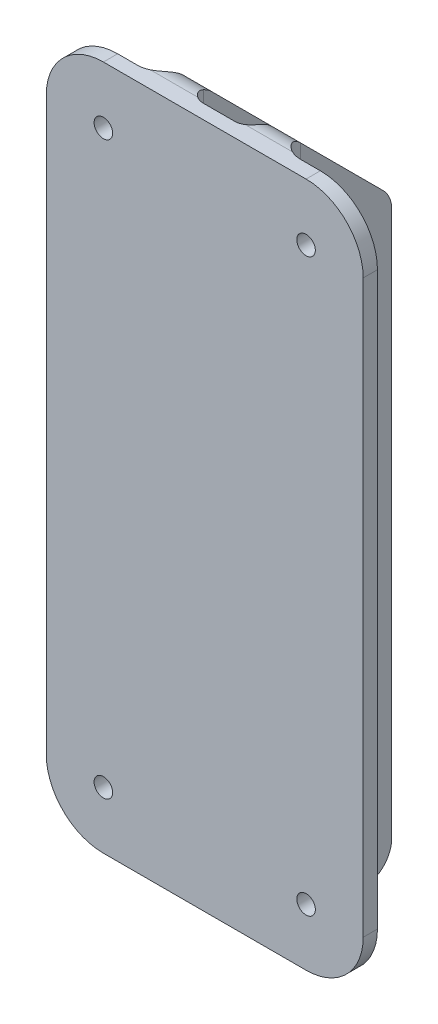
from build123d import *

# Parameters (mm, degrees)
SKETCH1_W            = 111
SKETCH1_H            = 240
BOSS_EXTRUDE1_DEPTH  = 5
FILLET1_R            = 20
SKETCH2_R            = 4.25
BOSS_EXTRUDE2_DEPTH  = 10
FILLET2_R            = 8
FILLET3_R            = 5
FILLET2_OF_MIRROR1_R = 8
FILLET3_OF_MIRROR1_R = 5
SKETCH3_R            = 3.25
CUT_EXTRUDE1_DEPTH   = 250.560113109
SKETCH4_R            = 8
CUT_EXTRUDE2_DEPTH   = 250.560113109


with BuildPart() as part:
    # Sketch1 → Boss-Extrude1 (new body)
    with BuildSketch(Plane.XY):
        with Locations((0, 120)):
            Rectangle(SKETCH1_W, SKETCH1_H)
    extrude(amount=BOSS_EXTRUDE1_DEPTH)

    # Fillet1
    fillet1_edges = [part.edges().sort_by_distance(p)[0] for p in [
        (-55.5, 240, 2.5),
        (55.5, 240, 2.5),
        (55.5, 0, 2.5),
        (-55.5, 0, 2.5),
    ]]
    fillet(fillet1_edges, radius=FILLET1_R)

    # Sketch2 → Boss-Extrude2 (add)
    with BuildSketch(Plane(origin=(10.5, 0, 0), x_dir=(0, 0, -1), z_dir=(1, 0, 0))):
        with BuildLine():
            Line((0, 0), (30, 0))
            ThreePointArc((30, 0), (37.071067812, 2.928932188), (40, 10))
            Line((40, 10), (40, 200.857864376))
            ThreePointArc((40, 200.857864376), (39.238795325, 204.6846987), (37.071067812, 207.928932188))
            Line((37.071067812, 207.928932188), (7.928932188, 237.071067812))
            ThreePointArc((7.928932188, 237.071067812), (4.6846987, 239.238795325), (0.857864376, 240))
            Line((0.857864376, 240), (0, 240))
            Line((0, 240), (0, 0))
        make_face()
        with Locations((20, 190)):
            Circle(SKETCH2_R, mode=Mode.SUBTRACT)
        with Locations((20, 20)):
            Circle(SKETCH2_R, mode=Mode.SUBTRACT)
    boss_extrude2 = extrude(amount=BOSS_EXTRUDE2_DEPTH)

    # Fillet2
    fillet2_edges = [part.edges().sort_by_distance(p)[0] for p in [
        (20.5, 120, 0),
    ]]
    fillet(fillet2_edges, radius=FILLET2_R)

    # Fillet3
    fillet3_edges = [part.edges().sort_by_distance(p)[0] for p in [
        (10.5, 120, 0),
    ]]
    fillet(fillet3_edges, radius=FILLET3_R)

    # Mirror1: Boss-Extrude2 across plane
    add(boss_extrude2.mirror(Plane(origin=(0, 0, 0), x_dir=(0, 0, 1), z_dir=(1, 0, 0))))

    # Fillet2 of Mirror1
    fillet2_of_mirror1_edges = [part.edges().sort_by_distance(p)[0] for p in [
        (-20.5, 120, 0),
    ]]
    fillet(fillet2_of_mirror1_edges, radius=FILLET2_OF_MIRROR1_R)

    # Fillet3 of Mirror1
    fillet3_of_mirror1_edges = [part.edges().sort_by_distance(p)[0] for p in [
        (-10.5, 120, 0),
    ]]
    fillet(fillet3_of_mirror1_edges, radius=FILLET3_OF_MIRROR1_R)

    # Sketch3 → Cut-Extrude1 (cut, through all)
    with BuildSketch(Plane(origin=(0, 0, 0), x_dir=(-1, 0, 0), z_dir=(0, 0, -1))):
        with Locations((-35.5, 220)):
            Circle(SKETCH3_R)
        with Locations((-35.5, 20)):
            Circle(SKETCH3_R)
        with Locations((35.5, 20)):
            Circle(SKETCH3_R)
        with Locations((35.5, 220)):
            Circle(SKETCH3_R)
    extrude(amount=-CUT_EXTRUDE1_DEPTH, mode=Mode.SUBTRACT)

    # Sketch4 → Cut-Extrude2 (cut, through all)
    with BuildSketch(Plane(origin=(0, 0, 0), x_dir=(-1, 0, 0), z_dir=(0, 0, -1))):
        with Locations((-35.5, 220)):
            Circle(SKETCH4_R)
        with Locations((35.5, 220)):
            Circle(SKETCH4_R)
        with Locations((35.5, 20)):
            Circle(SKETCH4_R)
        with Locations((-35.5, 20)):
            Circle(SKETCH4_R)
    extrude(amount=CUT_EXTRUDE2_DEPTH, mode=Mode.SUBTRACT)


solid = part.part
